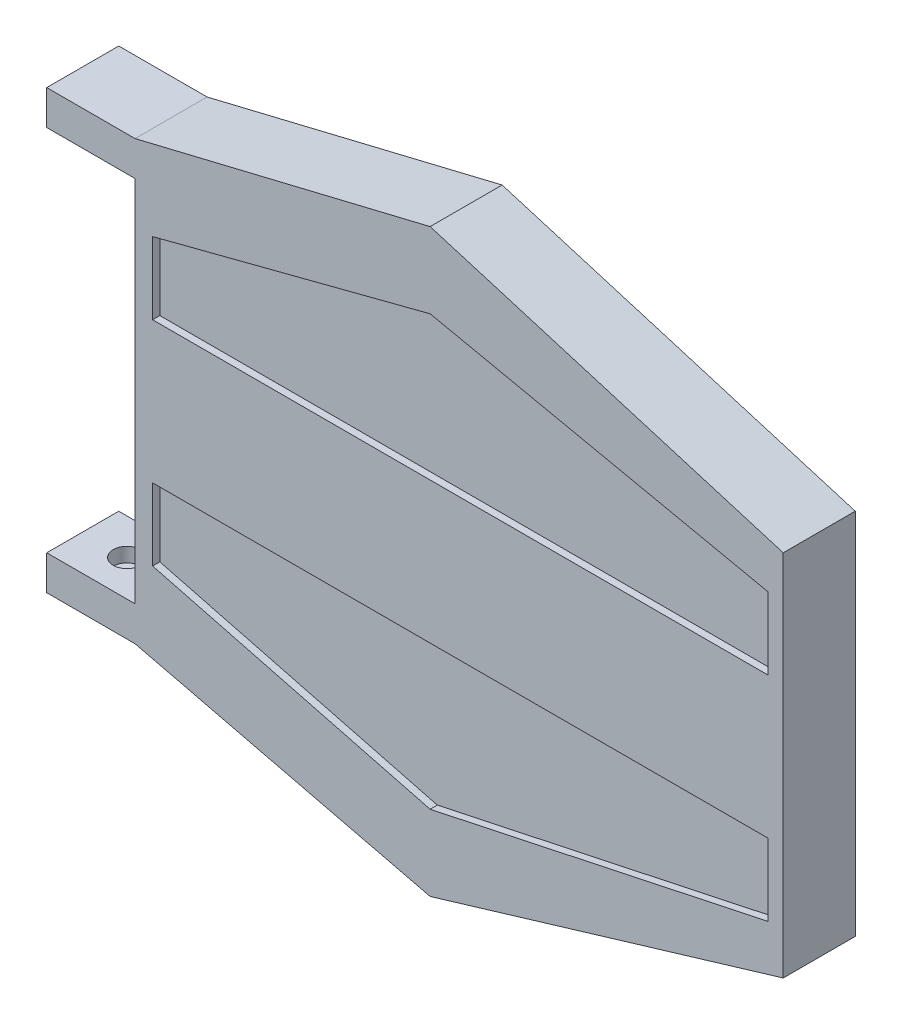
from build123d import *

# Parameters (mm, degrees)
BOSS_EXTRUDE1_DEPTH = 2.54
CUT_EXTRUDE2_DEPTH  = 0.254
SKETCH5_R           = 0.482014483
CUT_EXTRUDE3_DEPTH  = 0.508
SKETCH6_R           = 0.508
CUT_EXTRUDE4_DEPTH  = 0.508


with BuildPart() as part:
    # Sketch1 → Boss-Extrude1 (new body)
    with BuildSketch(Plane.XY):
        Polygon((-10.407081712, 5.223554475), (0, 7.738599222), (12.452918288, 4.002723735), (12.452918288, -8.983891051), (0, -12.719766537), (-10.407081712, -10.20472179), (-12.275019455, -10.20472179), (-13.520311284, -10.20472179), (-13.520311284, -8.983891051), (-10.407081712, -8.983891051), (-10.407081712, 4.002723735), (-13.520311284, 4.002723735), (-13.520311284, 5.223554475), (-12.275019455, 5.223554475), align=None)
    extrude(amount=BOSS_EXTRUDE1_DEPTH)

    # Sketch4 → Cut-Extrude2 (cut)
    with BuildSketch(Plane.XY.offset(2.54)):
        Polygon((-9.78623868, 0), (11.923219726, 0), (11.923219726, 2.54), (0, 5.075533386), (-9.78623868, 2.54), align=None)
        Polygon((0, -10.056700701), (-9.78623868, -7.521167315), (-9.78623868, -4.981167315), (11.923219726, -4.981167315), (11.923219726, -7.521167315), align=None)
    extrude(amount=-CUT_EXTRUDE2_DEPTH, mode=Mode.SUBTRACT)

    # Sketch5 → Cut-Extrude3 (cut)
    with BuildSketch(Plane(origin=(0, -8.983891051, 0), x_dir=(1, 0, 0), z_dir=(0, 1, 0))):
        with Locations(Location((-11.963696498, -1.27, 0), (0, 0, 270))):
            Circle(SKETCH5_R)
    extrude(amount=-CUT_EXTRUDE3_DEPTH, mode=Mode.SUBTRACT)

    # Sketch6 → Cut-Extrude4 (cut)
    with BuildSketch(Plane.XZ.offset(-4.002723735)):
        with Locations(Location((-11.963696498, 1.27, 0), (0, 0, 270))):
            Circle(SKETCH6_R)
    extrude(amount=-CUT_EXTRUDE4_DEPTH, mode=Mode.SUBTRACT)


solid = part.part
